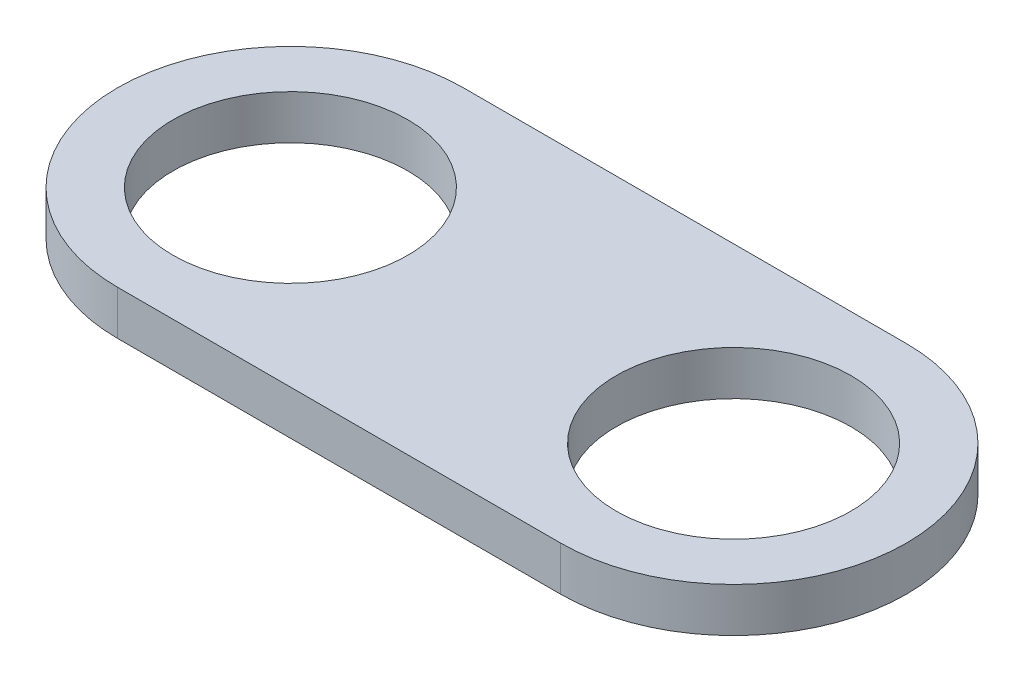
from build123d import *

# Parameters (mm, degrees)
SKETCH1_R           = 5.3
BOSS_EXTRUDE1_DEPTH = 2


with BuildPart() as part:
    # Sketch1 → Boss-Extrude1 (new body)
    with BuildSketch(Plane(origin=(0, 0, 0), x_dir=(1, 0, 0), z_dir=(0, 1, 0))):
        with BuildLine():
            Line((-10, 7.8), (10, 7.8))
            ThreePointArc((10, 7.8), (17.8, 0), (10, -7.8))
            Line((10, -7.8), (-10, -7.8))
            ThreePointArc((-10, -7.8), (-17.8, 0), (-10, 7.8))
        make_face()
        with Locations(Location((-10, 0, 0), (0, 0, 270))):
            Circle(SKETCH1_R, mode=Mode.SUBTRACT)
        with Locations(Location((10, 0, 0), (0, 0, 270))):
            Circle(SKETCH1_R, mode=Mode.SUBTRACT)
    extrude(amount=BOSS_EXTRUDE1_DEPTH)


solid = part.part
